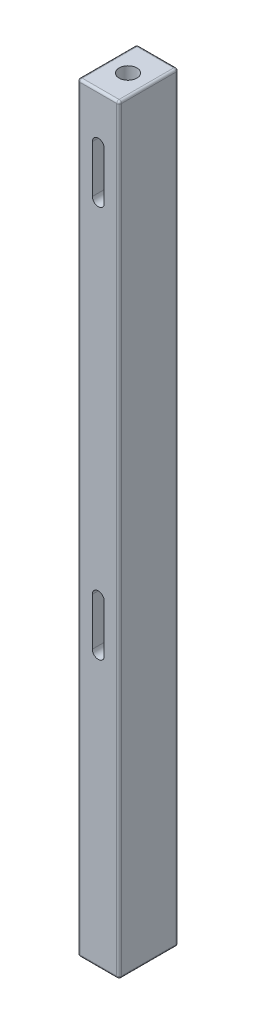
from build123d import *

# Parameters (mm, degrees)
SKETCH1_W           = 44.45
SKETCH1_H           = 63.5
BOSS_EXTRUDE1_DEPTH = 812.8
FILLET1_R           = 2.54
SKETCH2_R           = 9.525
CUT_EXTRUDE1_DEPTH  = 25.4
CUT_EXTRUDE2_DEPTH  = 23.495
CUT_EXTRUDE3_DEPTH  = 25.4


with BuildPart() as part:
    # Sketch1 → Boss-Extrude1 (new body)
    with BuildSketch(Plane(origin=(0, 0, 0), x_dir=(1, 0, 0), z_dir=(0, 1, 0))):
        Rectangle(SKETCH1_W, SKETCH1_H)
    extrude(amount=BOSS_EXTRUDE1_DEPTH)

    # Fillet1
    fillet1_edges = [part.edges().sort_by_distance(p)[0] for p in [
        (22.225, 812.8, 0),
        (0, 812.8, -31.75),
        (-22.225, 812.8, 0),
        (0, 0, -31.75),
        (22.225, 0, 0),
        (0, 0, 31.75),
        (-22.225, 0, 0),
        (0, 812.8, 31.75),
        (-22.225, 406.4, -31.75),
        (22.225, 406.4, -31.75),
        (22.225, 406.4, 31.75),
        (-22.225, 406.4, 31.75),
    ]]
    fillet(fillet1_edges, radius=FILLET1_R)

    # Sketch2 → Cut-Extrude1 (cut)
    with BuildSketch(Plane(origin=(0, 812.8, 0), x_dir=(1, 0, 0), z_dir=(0, 1, 0))):
        with Locations(Location((0, 0, 0), (0, 0, 270))):
            Circle(SKETCH2_R)
    extrude(amount=-CUT_EXTRUDE1_DEPTH, mode=Mode.SUBTRACT)

    # Sketch3 → Cut-Extrude2 (cut)
    with BuildSketch(Plane.ZY.offset(22.225)):
        with BuildLine():
            Line((-1.5875, 738.8225), (-1.5875, 129.2225))
            ThreePointArc((-1.5875, 129.2225), (-9.525, 121.285), (-17.4625, 129.2225))
            Line((-17.4625, 129.2225), (-17.4625, 738.8225))
            ThreePointArc((-17.4625, 738.8225), (-9.525, 746.76), (-1.5875, 738.8225))
        make_face()
    extrude(amount=-CUT_EXTRUDE2_DEPTH, mode=Mode.SUBTRACT)

    # Sketch4 → Cut-Extrude3 (cut)
    with BuildSketch(Plane.XY.offset(31.75)):
        with BuildLine():
            Line((6.35, 342.9), (6.35, 292.1))
            ThreePointArc((6.35, 292.1), (0, 285.75), (-6.35, 292.1))
            Line((-6.35, 292.1), (-6.35, 342.9))
            ThreePointArc((-6.35, 342.9), (0, 349.25), (6.35, 342.9))
        make_face()
        with BuildLine():
            Line((6.35, 762), (6.35, 711.2))
            ThreePointArc((6.35, 711.2), (0, 704.85), (-6.35, 711.2))
            Line((-6.35, 711.2), (-6.35, 762))
            ThreePointArc((-6.35, 762), (0, 768.35), (6.35, 762))
        make_face()
    extrude(amount=-CUT_EXTRUDE3_DEPTH, mode=Mode.SUBTRACT)


solid = part.part
